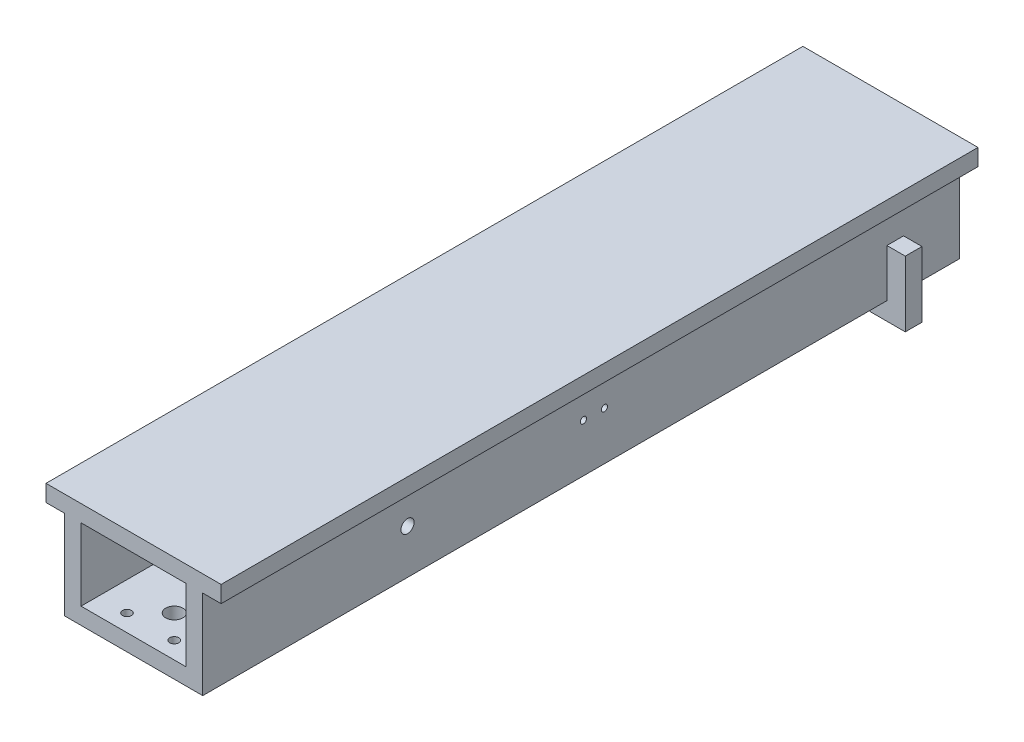
from build123d import *

# Parameters (mm, degrees)
SKETCH1_W                      = 52.7
SKETCH1_H                      = 40.2
SKETCH1_W_2                    = 40
SKETCH1_H_2                    = 27.5
BOSS_EXTRUDE1_DEPTH            = 46
SKETCH2_R                      = 1.7
SKETCH2_R_2                    = 3.25
CUT_EXTRUDE1_DEPTH             = 6.35
BOSS_EXTRUDE2_DEPTH            = 242.29
SKETCH4_W                      = 288.29
SKETCH4_H                      = 6.35
BOSS_EXTRUDE3_DEPTH            = 7
SKETCH6_W                      = 288.29
SKETCH6_H                      = 6.35
BOSS_EXTRUDE4_DEPTH            = 7
SKETCH7_W                      = 6.35
SKETCH7_H                      = 25
BOSS_EXTRUDE5_DEPTH            = 7
CUT_EXTRUDE2_REACH             = 297.989
SKETCH9_R                      = 2.5
CUT_EXTRUDE2_DIRECTION_2_REACH = 297.989
CUT_EXTRUDE3_REACH             = 253.822
SKETCH10_R                     = 1.2
SKETCH11_W                     = 21.35
SKETCH11_H                     = 6.8
SKETCH11_W_2                   = 214.59
CUT_EXTRUDE4_DEPTH             = 52.7
SKETCH12_W                     = 6.35
SKETCH12_H                     = 6.35
CUT_EXTRUDE5_DEPTH             = 6.8


with BuildPart() as part:
    # Sketch1 → Boss-Extrude1 (new body)
    with BuildSketch(Plane.XY):
        with Locations((20, 13.75)):
            Rectangle(SKETCH1_W, SKETCH1_H)
        with Locations((20, 13.75)):
            Rectangle(SKETCH1_W_2, SKETCH1_H_2, mode=Mode.SUBTRACT)
    extrude(amount=BOSS_EXTRUDE1_DEPTH)

    # Sketch2 → Cut-Extrude1 (cut)
    with BuildSketch(Plane.XZ.offset(6.35)):
        with Locations(Location((29, 39.5, 0), (0, 0, 270))):
            Circle(SKETCH2_R)
        with Locations(Location((11, 39.5, 0), (0, 0, 270))):
            Circle(SKETCH2_R)
        with Locations(Location((11, 6.5, 0), (0, 0, 270))):
            Circle(SKETCH2_R)
        with Locations(Location((29, 6.5, 0), (0, 0, 270))):
            Circle(SKETCH2_R)
        with Locations(Location((20, 30.5, 0), (0, 0, 270))):
            Circle(SKETCH2_R_2)
    extrude(amount=-CUT_EXTRUDE1_DEPTH, mode=Mode.SUBTRACT)

    # Sketch3 → Boss-Extrude2 (add)
    with BuildSketch(Plane(origin=(0, 0, 0), x_dir=(-1, 0, 0), z_dir=(0, 0, -1))):
        Polygon((6.35, 33.85), (6.35, -13.15), (0, -13.15), (0, 27.5), (-40, 27.5), (-40, -13.15), (-46.35, -13.15), (-46.35, 33.85), align=None)
    extrude(amount=BOSS_EXTRUDE2_DEPTH)

    # Sketch4 → Boss-Extrude3 (add)
    with BuildSketch(Plane.ZY.offset(6.35)):
        with Locations((-98.145, 30.675)):
            Rectangle(SKETCH4_W, SKETCH4_H)
    extrude(amount=BOSS_EXTRUDE3_DEPTH)

    # Sketch6 → Boss-Extrude4 (add)
    with BuildSketch(Plane(origin=(46.35, 0, 0), x_dir=(0, 0, -1), z_dir=(1, 0, 0))):
        with Locations((98.145, 30.675)):
            Rectangle(SKETCH6_W, SKETCH6_H)
    extrude(amount=BOSS_EXTRUDE4_DEPTH)

    # Sketch7 → Boss-Extrude5 (add)
    with BuildSketch(Plane(origin=(46.35, 0, 0), x_dir=(0, 0, -1), z_dir=(1, 0, 0))):
        with Locations((217.765, -0.65)):
            Rectangle(SKETCH7_W, SKETCH7_H)
    extrude(amount=BOSS_EXTRUDE5_DEPTH)

    # Cut-Extrude2: up to this face of the body (flat: up to its plane)
    cut_extrude2_end = Plane(part.part.faces().sort_by_distance((46.35, 7.756141986, -99.825781006))[0])
    # Sketch9 → Cut-Extrude2 (cut, up to the picked face)
    with BuildSketch(Plane(origin=(40, 27.5, -242.29), x_dir=(0, 0, 1), z_dir=(-1, 0, 0)), mode=Mode.PRIVATE) as cut_extrude2_sk1:
        with Locations((210.29, -16.925)):
            Circle(SKETCH9_R)
    cut_extrude2_tool1 = split(extrude(cut_extrude2_sk1.sketch, amount=-CUT_EXTRUDE2_REACH, mode=Mode.PRIVATE), bisect_by=cut_extrude2_end, keep=Keep.BOTH, mode=Mode.PRIVATE)
    add(cut_extrude2_tool1.solids().sort_by(Axis((40, 10.575, -32), (1, 0, 0)))[0], mode=Mode.SUBTRACT)

    # Cut-Extrude2 direction 2: up to this face of the body (flat: up to its plane)
    cut_extrude2_direction_2_end = Plane(part.part.faces().sort_by_distance((-6.35, 7.639146283, -101.467245288))[0])
    # Sketch9 → Cut-Extrude2 direction 2 (cut, up to the picked face)
    with BuildSketch(Plane(origin=(40, 27.5, -242.29), x_dir=(0, 0, 1), z_dir=(-1, 0, 0)), mode=Mode.PRIVATE) as cut_extrude2_direction_2_sk1:
        with Locations((210.29, -16.925)):
            Circle(SKETCH9_R)
    cut_extrude2_direction_2_tool1 = split(extrude(cut_extrude2_direction_2_sk1.sketch, amount=CUT_EXTRUDE2_DIRECTION_2_REACH, mode=Mode.PRIVATE), bisect_by=cut_extrude2_direction_2_end, keep=Keep.BOTH, mode=Mode.PRIVATE)
    add(cut_extrude2_direction_2_tool1.solids().sort_by(Axis((40, 10.575, -32), (-1, 0, 0)))[0], mode=Mode.SUBTRACT)

    # Cut-Extrude3: up to this face of the body (flat: up to its plane)
    cut_extrude3_end = Plane(part.part.faces().sort_by_distance((-6.35, 7.634083702, -101.587034491))[0])
    # Sketch10 → Cut-Extrude3 (cut, up to the picked face)
    with BuildSketch(Plane(origin=(46.35, 0, 0), x_dir=(0, 0, -1), z_dir=(1, 0, 0)), mode=Mode.PRIVATE) as cut_extrude3_sk1:
        with Locations((99, 24)):
            Circle(SKETCH10_R)
    cut_extrude3_tool1 = split(extrude(cut_extrude3_sk1.sketch, amount=-CUT_EXTRUDE3_REACH, mode=Mode.PRIVATE), bisect_by=cut_extrude3_end, keep=Keep.BOTH, mode=Mode.PRIVATE)
    # Sketch10 → Cut-Extrude3 (cut, up to the picked face)
    with BuildSketch(Plane(origin=(46.35, 0, 0), x_dir=(0, 0, -1), z_dir=(1, 0, 0)), mode=Mode.PRIVATE) as cut_extrude3_sk2:
        with Locations((99, 12)):
            Circle(SKETCH10_R)
    cut_extrude3_tool2 = split(extrude(cut_extrude3_sk2.sketch, amount=-CUT_EXTRUDE3_REACH, mode=Mode.PRIVATE), bisect_by=cut_extrude3_end, keep=Keep.BOTH, mode=Mode.PRIVATE)
    # Sketch10 → Cut-Extrude3 (cut, up to the picked face)
    with BuildSketch(Plane(origin=(46.35, 0, 0), x_dir=(0, 0, -1), z_dir=(1, 0, 0)), mode=Mode.PRIVATE) as cut_extrude3_sk3:
        with Locations((107, 12)):
            Circle(SKETCH10_R)
    cut_extrude3_tool3 = split(extrude(cut_extrude3_sk3.sketch, amount=-CUT_EXTRUDE3_REACH, mode=Mode.PRIVATE), bisect_by=cut_extrude3_end, keep=Keep.BOTH, mode=Mode.PRIVATE)
    # Sketch10 → Cut-Extrude3 (cut, up to the picked face)
    with BuildSketch(Plane(origin=(46.35, 0, 0), x_dir=(0, 0, -1), z_dir=(1, 0, 0)), mode=Mode.PRIVATE) as cut_extrude3_sk4:
        with Locations((107, 24)):
            Circle(SKETCH10_R)
    cut_extrude3_tool4 = split(extrude(cut_extrude3_sk4.sketch, amount=-CUT_EXTRUDE3_REACH, mode=Mode.PRIVATE), bisect_by=cut_extrude3_end, keep=Keep.BOTH, mode=Mode.PRIVATE)
    add(cut_extrude3_tool1.solids().sort_by(Axis((46.35, 24, -99), (-1, 0, 0)))[0], mode=Mode.SUBTRACT)
    add(cut_extrude3_tool2.solids().sort_by(Axis((46.35, 12, -99), (-1, 0, 0)))[0], mode=Mode.SUBTRACT)
    add(cut_extrude3_tool3.solids().sort_by(Axis((46.35, 12, -107), (-1, 0, 0)))[0], mode=Mode.SUBTRACT)
    add(cut_extrude3_tool4.solids().sort_by(Axis((46.35, 24, -107), (-1, 0, 0)))[0], mode=Mode.SUBTRACT)

    # Sketch11 → Cut-Extrude4 (cut)
    with BuildSketch(Plane(origin=(46.35, 0, 0), x_dir=(0, 0, -1), z_dir=(1, 0, 0))):
        with Locations((231.615, -9.75)):
            Rectangle(SKETCH11_W, SKETCH11_H)
        with Locations((107.295, -9.75)):
            Rectangle(SKETCH11_W_2, SKETCH11_H)
    extrude(amount=-CUT_EXTRUDE4_DEPTH, mode=Mode.SUBTRACT)

    # Sketch12 → Cut-Extrude5 (cut)
    with BuildSketch(Plane.XZ.offset(13.15)):
        with Locations((-3.175, -217.765)):
            Rectangle(SKETCH12_W, SKETCH12_H)
    extrude(amount=-CUT_EXTRUDE5_DEPTH, mode=Mode.SUBTRACT)


solid = part.part
